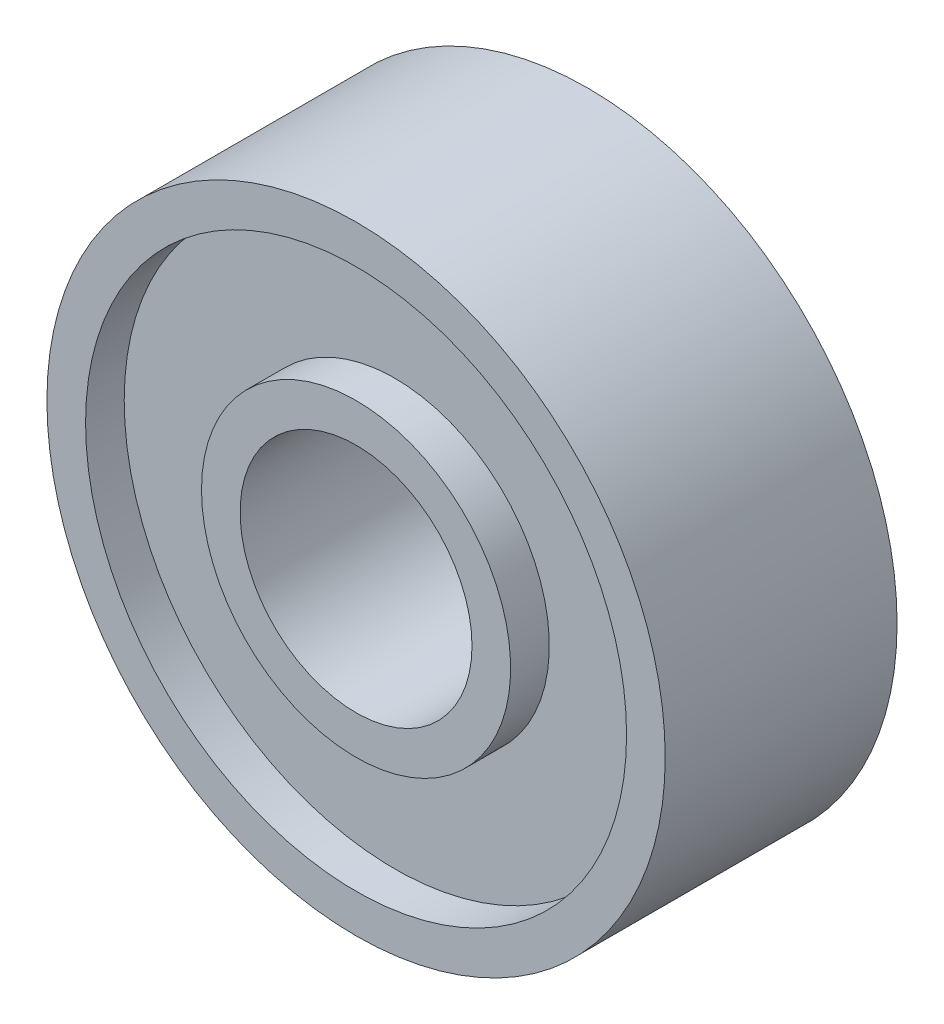
from build123d import *

# Parameters (mm, degrees)
SKETCH1_R           = 4
SKETCH1_R_2         = 1.5
BOSS_EXTRUDE1_DEPTH = 1.5
CUT_EXTRUDE1_START  = -0.5
SKETCH2_R           = 3.5
SKETCH2_R_2         = 2
CUT_EXTRUDE1_DEPTH  = 7.903124237


with BuildPart() as part:
    # Sketch1 → Boss-Extrude1 (new, symmetric)
    with BuildSketch(Plane.XY):
        Circle(SKETCH1_R)
        Circle(SKETCH1_R_2, mode=Mode.SUBTRACT)
    extrude(amount=BOSS_EXTRUDE1_DEPTH, both=True)

    # Sketch2 → Cut-Extrude1 (cut)
    with BuildSketch(Plane.XY.offset(1.5).offset(CUT_EXTRUDE1_START)):
        with Locations(Location((0, 0, 0), (0, 0, 180))):
            Circle(SKETCH2_R)
        with Locations(Location((0, 0, 0), (0, 0, 180))):
            Circle(SKETCH2_R_2, mode=Mode.SUBTRACT)
    cut_extrude1 = extrude(amount=CUT_EXTRUDE1_DEPTH, mode=Mode.SUBTRACT)

    # Mirror1: Cut-Extrude1 across plane
    add(cut_extrude1.mirror(Plane.XY), mode=Mode.SUBTRACT)


solid = part.part
